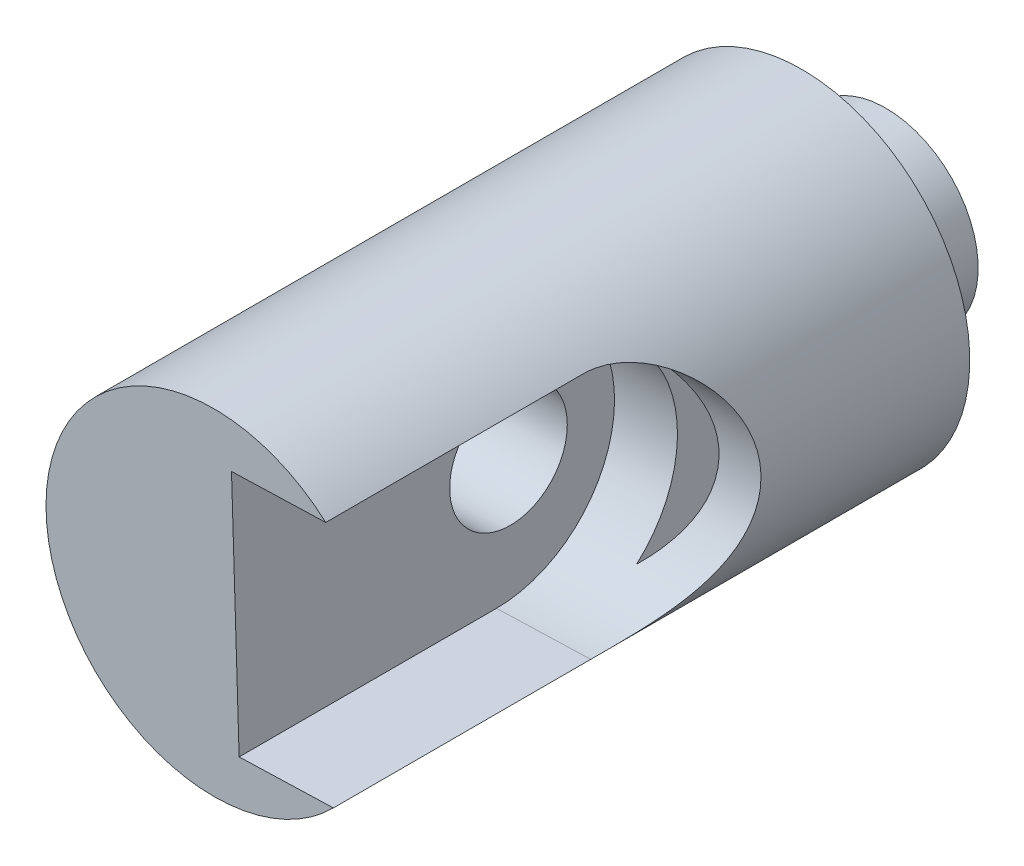
from build123d import *

# Parameters (mm, degrees)
BOSS_EXTRUDE1_START = -10
SKETCH2_R           = 20
BOSS_EXTRUDE1_DEPTH = 30
SKETCH5_R           = 20
SKETCH5_R_2         = 11
CUT_EXTRUDE1_DEPTH  = 10
SKETCH7_R           = 20
BOSS_EXTRUDE2_DEPTH = 50
CUT_EXTRUDE2_DEPTH  = 50
CUT_EXTRUDE3_START  = -7.5
CUT_EXTRUDE3_DEPTH  = 87.335902125
SKETCH10_R          = 7
CUT_EXTRUDE4_DEPTH  = 77.23263398


with BuildPart() as part:
    # Sketch2 → Boss-Extrude1 (new body)
    with BuildSketch(Plane.XY.offset(BOSS_EXTRUDE1_START)):
        Circle(SKETCH2_R)
    extrude(amount=BOSS_EXTRUDE1_DEPTH)

    # Sketch5 → Cut-Extrude1 (cut)
    with BuildSketch(Plane(origin=(0, 0, -10), x_dir=(-1, 0, 0), z_dir=(0, 0, -1))):
        Circle(SKETCH5_R)
        Circle(SKETCH5_R_2, mode=Mode.SUBTRACT)
    extrude(amount=-CUT_EXTRUDE1_DEPTH, mode=Mode.SUBTRACT)

    # Sketch7 → Boss-Extrude2 (add)
    with BuildSketch(Plane.XY.offset(20)):
        with Locations(Location((0, 0, 0), (0, 0, 180))):
            Circle(SKETCH7_R)
    extrude(amount=BOSS_EXTRUDE2_DEPTH)

    # Sketch8 → Cut-Extrude2 (cut)
    with BuildSketch(Plane.XY.offset(70)):
        with BuildLine():
            ThreePointArc((15, 0), (13.608051098, 6.310383928), (9.690540625, 11.449603591))
            Line((9.690540625, 11.449603591), (10.389343078, -10.819498621))
            ThreePointArc((10.389343078, -10.819498621), (13.799277991, -5.880469957), (15, 0))
        make_face()
    extrude(amount=-CUT_EXTRUDE2_DEPTH, mode=Mode.SUBTRACT)

    # Sketch9 → Cut-Extrude3 (cut, through all)
    with BuildSketch(Plane(origin=(10.039941851, 0.315052485, 0), x_dir=(0, 0, -1), z_dir=(0.9995080138957542, 0.03136447286604987, 0)).offset(CUT_EXTRUDE3_START)):
        with BuildLine():
            Line((-39.352049218, 14.5), (-72.599055299, 14.5))
            Line((-72.599055299, 14.5), (-72.599055299, -14.5))
            Line((-72.599055299, -14.5), (-39.352049218, -14.5))
            ThreePointArc((-39.352049218, -14.5), (-24.852049218, 0), (-39.352049218, 14.5))
        make_face()
    extrude(amount=CUT_EXTRUDE3_DEPTH, mode=Mode.SUBTRACT)

    # Sketch10 → Cut-Extrude4 (cut, through all)
    with BuildSketch(Plane(origin=(2.543631747, 0.079818939, 0), x_dir=(0, 0, -1), z_dir=(0.9995080138957542, 0.03136447286604988, 0))):
        with Locations(Location((-37.473518474, 0, 0), (0, 0, 90))):
            Circle(SKETCH10_R)
    extrude(amount=-CUT_EXTRUDE4_DEPTH, mode=Mode.SUBTRACT)


solid = part.part
